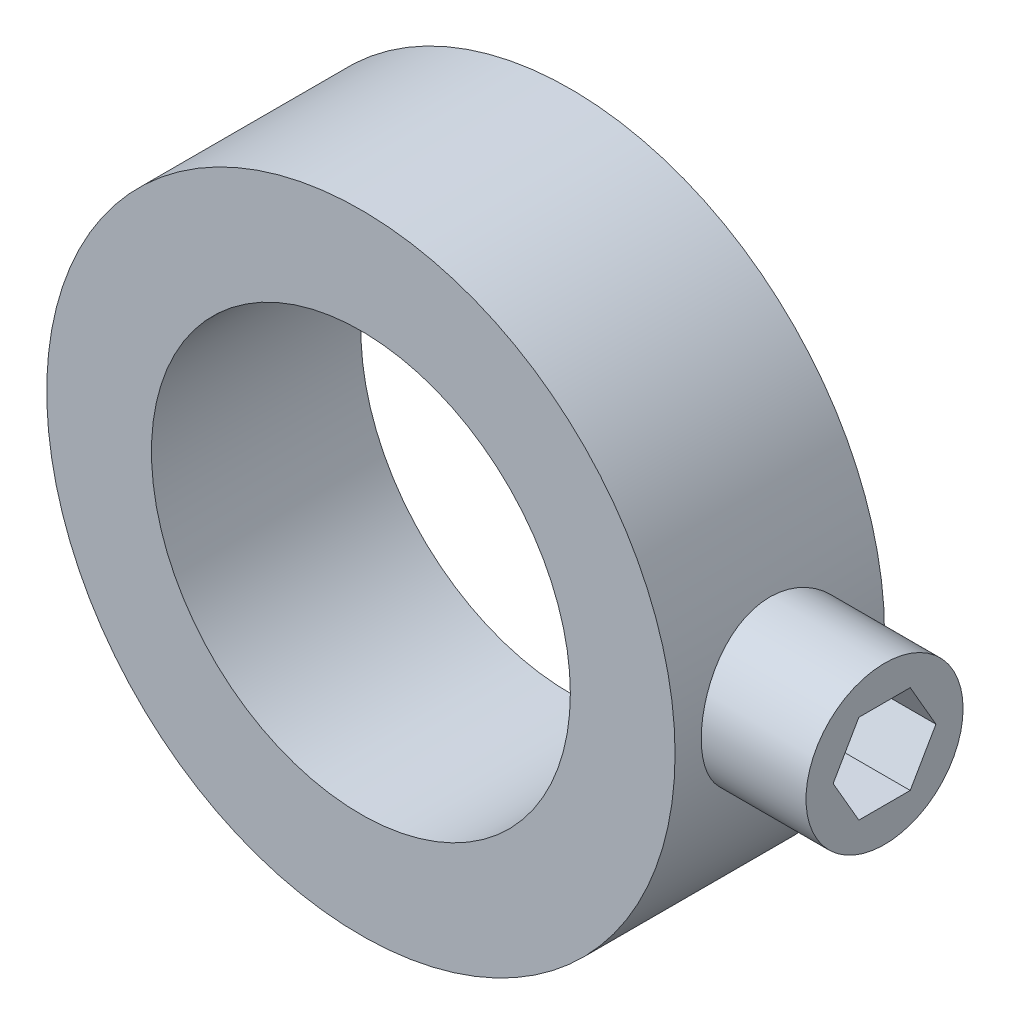
from build123d import *

# Parameters (mm, degrees)
SKETCH1_R                = 6
SKETCH1_R_2              = 4
BOSS_EXTRUDE1_DEPTH      = 4
BOSS_EXTRUDE2_DEPTH      = 2
BOSS_EXTRUDE2_DEPTH_BACK = 1
SKETCH2_R                = 1.5
CUT_EXTRUDE1_DEPTH       = 1.5


with BuildPart() as part:
    # Sketch1 → Boss-Extrude1 (new body)
    with BuildSketch(Plane.XY):
        Circle(SKETCH1_R)
        Circle(SKETCH1_R_2, mode=Mode.SUBTRACT)
    extrude(amount=BOSS_EXTRUDE1_DEPTH)

    # Sketch2 → Boss-Extrude2 (add, two sides: drawn at the far end of the back side and taken through both)
    with BuildSketch(Plane(origin=(6, 0, 0), x_dir=(0, 0, -1), z_dir=(1, 0, 0)).offset(-BOSS_EXTRUDE2_DEPTH_BACK)):
        with Locations((-2, 0)):
            Circle(SKETCH2_R)
    extrude(amount=BOSS_EXTRUDE2_DEPTH + BOSS_EXTRUDE2_DEPTH_BACK)

    # Sketch3 → Cut-Extrude1 (cut)
    with BuildSketch(Plane(origin=(8, 0, 0), x_dir=(0, 0, -1), z_dir=(1, 0, 0))):
        Polygon((-2.490747729, 0.85), (-1.509252271, 0.85), (-1.018504542, 0), (-1.509252271, -0.85), (-2.490747729, -0.85), (-2.981495458, 0), align=None)
    extrude(amount=-CUT_EXTRUDE1_DEPTH, mode=Mode.SUBTRACT)


solid = part.part
